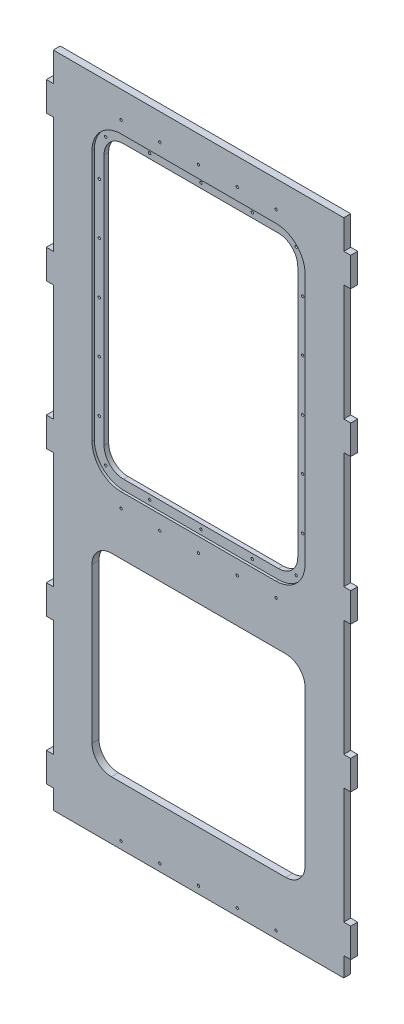
from build123d import *

# Parameters (mm, degrees)
SKETCH2_W               = 381
SKETCH2_H               = 1727.2
BOSS_EXTRUDE1_DEPTH     = 18.288
SKETCH3_W               = 18.288
SKETCH3_H               = 76.2
BOSS_EXTRUDE2_DEPTH     = 18.288
LPATTERN1_COUNT         = 5
LPATTERN1_PITCH         = 381
MIRROR1_COPY_1_SKETCH_W = 18.288
MIRROR1_COPY_1_SKETCH_H = 76.2
MIRROR1_COPY_1_DEPTH    = 18.288
MIRROR1_COPY_2_SKETCH_W = 18.288
MIRROR1_COPY_2_SKETCH_H = 76.2
MIRROR1_COPY_2_DEPTH    = 18.288
MIRROR1_COPY_3_SKETCH_W = 18.288
MIRROR1_COPY_3_SKETCH_H = 76.2
MIRROR1_COPY_3_DEPTH    = 18.288
MIRROR1_COPY_4_SKETCH_W = 18.288
MIRROR1_COPY_4_SKETCH_H = 76.2
MIRROR1_COPY_4_DEPTH    = 18.288
CUT_EXTRUDE2_DEPTH      = 1896.363726014
CUT_EXTRUDE4_DEPTH      = 6.35
SKETCH7_R               = 3.175
CUT_EXTRUDE6_DEPTH      = 25.4
SKETCH8_W               = 558.8
SKETCH8_H               = 508
CUT_EXTRUDE7_DEPTH      = 25.4
FILLET1_R               = 50.8
SKETCH10_R              = 3.175
CUT_EXTRUDE8_DEPTH      = 25.4
SKETCH12_R              = 3.175
CUT_EXTRUDE9_DEPTH      = 1896.363726014
SKETCH13_R              = 3.175
CUT_EXTRUDE10_DEPTH     = 1896.363726014


with BuildPart() as part:
    # Sketch2 → Boss-Extrude1 (new body)
    with BuildSketch(Plane.XY):
        with Locations((190.5, 863.6)):
            Rectangle(SKETCH2_W, SKETCH2_H)
    boss_extrude1 = extrude(amount=-BOSS_EXTRUDE1_DEPTH)

    # Sketch3 → Boss-Extrude2 (add)
    with BuildSketch(Plane.XY):
        with Locations((-9.144, 88.9)):
            Rectangle(SKETCH3_W, SKETCH3_H)
    boss_extrude2 = extrude(amount=-BOSS_EXTRUDE2_DEPTH)

    # LPattern1: Boss-Extrude2 ×5
    with Locations(*[(0, i * LPATTERN1_PITCH, 0) for i in range(1, LPATTERN1_COUNT)]):
        add(boss_extrude2)

    # Mirror1: Boss-Extrude1, Boss-Extrude2 across plane
    add(boss_extrude1.mirror(Plane(origin=(381, 0, -18.288), x_dir=(0, 0, 1), z_dir=(1, 0, 0))))
    add(boss_extrude2.mirror(Plane(origin=(381, 0, -18.288), x_dir=(0, 0, 1), z_dir=(1, 0, 0))))

    # Mirror1 copy 1 sketch → Mirror1 copy 1 (add)
    with BuildSketch(Plane(origin=(762, 381, 0), x_dir=(-1, 0, 0), z_dir=(0, 0, 1))):
        with Locations((-9.144, -88.9)):
            Rectangle(MIRROR1_COPY_1_SKETCH_W, MIRROR1_COPY_1_SKETCH_H)
    extrude(amount=-MIRROR1_COPY_1_DEPTH)

    # Mirror1 copy 2 sketch → Mirror1 copy 2 (add)
    with BuildSketch(Plane(origin=(762, 762, 0), x_dir=(-1, 0, 0), z_dir=(0, 0, 1))):
        with Locations((-9.144, -88.9)):
            Rectangle(MIRROR1_COPY_2_SKETCH_W, MIRROR1_COPY_2_SKETCH_H)
    extrude(amount=-MIRROR1_COPY_2_DEPTH)

    # Mirror1 copy 3 sketch → Mirror1 copy 3 (add)
    with BuildSketch(Plane(origin=(762, 1143, 0), x_dir=(-1, 0, 0), z_dir=(0, 0, 1))):
        with Locations((-9.144, -88.9)):
            Rectangle(MIRROR1_COPY_3_SKETCH_W, MIRROR1_COPY_3_SKETCH_H)
    extrude(amount=-MIRROR1_COPY_3_DEPTH)

    # Mirror1 copy 4 sketch → Mirror1 copy 4 (add)
    with BuildSketch(Plane(origin=(762, 1524, 0), x_dir=(-1, 0, 0), z_dir=(0, 0, 1))):
        with Locations((-9.144, -88.9)):
            Rectangle(MIRROR1_COPY_4_SKETCH_W, MIRROR1_COPY_4_SKETCH_H)
    extrude(amount=-MIRROR1_COPY_4_DEPTH)

    # Sketch4 → Cut-Extrude2 (cut, through all)
    with BuildSketch(Plane.XY):
        with BuildLine():
            Line((177.8, 1600.2), (584.2, 1600.2))
            ThreePointArc((584.2, 1600.2), (620.121024484, 1585.321024484), (635, 1549.4))
            Line((635, 1549.4), (635, 889))
            ThreePointArc((635, 889), (620.121024484, 853.078975516), (584.2, 838.2))
            Line((584.2, 838.2), (177.8, 838.2))
            ThreePointArc((177.8, 838.2), (141.878975516, 853.078975516), (127, 889))
            Line((127, 889), (127, 1549.4))
            ThreePointArc((127, 1549.4), (141.878975516, 1585.321024484), (177.8, 1600.2))
        make_face()
    extrude(amount=-CUT_EXTRUDE2_DEPTH, mode=Mode.SUBTRACT)

    # Sketch5 → Cut-Extrude4 (cut)
    with BuildSketch(Plane.XY):
        with BuildLine():
            Line((177.8, 1625.6), (584.2, 1625.6))
            ThreePointArc((584.2, 1625.6), (638.081536726, 1603.281536726), (660.4, 1549.4))
            Line((660.4, 1549.4), (660.4, 889))
            ThreePointArc((660.4, 889), (638.081536726, 835.118463274), (584.2, 812.8))
            Line((584.2, 812.8), (177.8, 812.8))
            ThreePointArc((177.8, 812.8), (123.918463274, 835.118463274), (101.6, 889))
            Line((101.6, 889), (101.6, 1549.4))
            ThreePointArc((101.6, 1549.4), (123.918463274, 1603.281536726), (177.8, 1625.6))
        make_face()
        with BuildLine():
            Line((177.8, 1600.2), (584.2, 1600.2))
            ThreePointArc((584.2, 1600.2), (620.121024484, 1585.321024484), (635, 1549.4))
            Line((635, 1549.4), (635, 889))
            ThreePointArc((635, 889), (620.121024484, 853.078975516), (584.2, 838.2))
            Line((584.2, 838.2), (177.8, 838.2))
            ThreePointArc((177.8, 838.2), (141.878975516, 853.078975516), (127, 889))
            Line((127, 889), (127, 1549.4))
            ThreePointArc((127, 1549.4), (141.878975516, 1585.321024484), (177.8, 1600.2))
        make_face(mode=Mode.SUBTRACT)
    extrude(amount=-CUT_EXTRUDE4_DEPTH, mode=Mode.SUBTRACT)

    # Sketch7 → Cut-Extrude6 (cut)
    with BuildSketch(Plane.XY.offset(-6.35)):
        with Locations((381, 825.5)):
            Circle(SKETCH7_R)
        with Locations((515.62, 825.5)):
            Circle(SKETCH7_R)
        with Locations(Location((246.38, 825.5, 0), (0, 0, 180))):
            Circle(SKETCH7_R)
        with Locations(Location((381, 1612.9, 0), (0, 0, 180))):
            Circle(SKETCH7_R)
        with Locations(Location((114.3, 1219.2, 0), (0, 0, 180))):
            Circle(SKETCH7_R)
        with Locations((515.62, 1612.9)):
            Circle(SKETCH7_R)
        with Locations(Location((246.38, 1612.9, 0), (0, 0, 180))):
            Circle(SKETCH7_R)
        with Locations(Location((114.3, 1353.82, 0), (0, 0, 180))):
            Circle(SKETCH7_R)
        with Locations(Location((114.3, 1488.44, 0), (0, 0, 180))):
            Circle(SKETCH7_R)
        with Locations((114.3, 949.96)):
            Circle(SKETCH7_R)
        with Locations((114.3, 1084.58)):
            Circle(SKETCH7_R)
        with Locations(Location((647.7, 1084.58, 0), (0, 0, 180))):
            Circle(SKETCH7_R)
        with Locations(Location((647.7, 949.96, 0), (0, 0, 180))):
            Circle(SKETCH7_R)
        with Locations((647.7, 1488.44)):
            Circle(SKETCH7_R)
        with Locations((647.7, 1353.82)):
            Circle(SKETCH7_R)
        with Locations((647.7, 1219.2)):
            Circle(SKETCH7_R)
    extrude(amount=-CUT_EXTRUDE6_DEPTH, mode=Mode.SUBTRACT)

    # Sketch8 → Cut-Extrude7 (cut)
    with BuildSketch(Plane.XY):
        with Locations((381, 406.4)):
            Rectangle(SKETCH8_W, SKETCH8_H)
    extrude(amount=-CUT_EXTRUDE7_DEPTH, mode=Mode.SUBTRACT)

    # Fillet1
    fillet1_edges = [part.edges().sort_by_distance(p)[0] for p in [
        (101.6, 152.4, -9.144),
        (101.6, 660.4, -9.144),
        (660.4, 660.4, -9.144),
        (660.4, 152.4, -9.144),
    ]]
    fillet(fillet1_edges, radius=FILLET1_R)

    # Sketch10 → Cut-Extrude8 (cut)
    with BuildSketch(Plane.XY.offset(-6.35)):
        with Locations((131.268636066, 1592.300329375)):
            Circle(SKETCH10_R)
        with Locations(Location((131.268636066, 846.099670625, 0), (0, 0, 180))):
            Circle(SKETCH10_R)
        with Locations((630.731363934, 846.099670625)):
            Circle(SKETCH10_R)
        with Locations(Location((630.731363934, 1592.300329375, 0), (0, 0, 180))):
            Circle(SKETCH10_R)
    extrude(amount=-CUT_EXTRUDE8_DEPTH, mode=Mode.SUBTRACT)

    # Sketch12 → Cut-Extrude9 (cut, through all)
    with BuildSketch(Plane(origin=(0, 0, -18.288), x_dir=(-1, 0, 0), z_dir=(0, 0, -1))):
        with Locations((-177.8, 774.7)):
            Circle(SKETCH12_R)
        with Locations((-279.4, 774.7)):
            Circle(SKETCH12_R)
        with Locations((-381, 774.7)):
            Circle(SKETCH12_R)
        with Locations((-482.6, 774.7)):
            Circle(SKETCH12_R)
        with Locations((-584.2, 774.7)):
            Circle(SKETCH12_R)
        with Locations((-177.8, 19.05)):
            Circle(SKETCH12_R)
        with Locations((-279.4, 19.05)):
            Circle(SKETCH12_R)
        with Locations((-381, 19.05)):
            Circle(SKETCH12_R)
        with Locations((-482.6, 19.05)):
            Circle(SKETCH12_R)
        with Locations((-584.2, 19.05)):
            Circle(SKETCH12_R)
    extrude(amount=-CUT_EXTRUDE9_DEPTH, mode=Mode.SUBTRACT)

    # Sketch13 → Cut-Extrude10 (cut, through all)
    with BuildSketch(Plane(origin=(0, 0, -18.288), x_dir=(-1, 0, 0), z_dir=(0, 0, -1))):
        with Locations((-584.2, 1657.35)):
            Circle(SKETCH13_R)
        with Locations((-482.6, 1657.35)):
            Circle(SKETCH13_R)
        with Locations((-381, 1657.35)):
            Circle(SKETCH13_R)
        with Locations((-279.4, 1657.35)):
            Circle(SKETCH13_R)
        with Locations((-177.8, 1657.35)):
            Circle(SKETCH13_R)
    extrude(amount=-CUT_EXTRUDE10_DEPTH, mode=Mode.SUBTRACT)


solid = part.part
